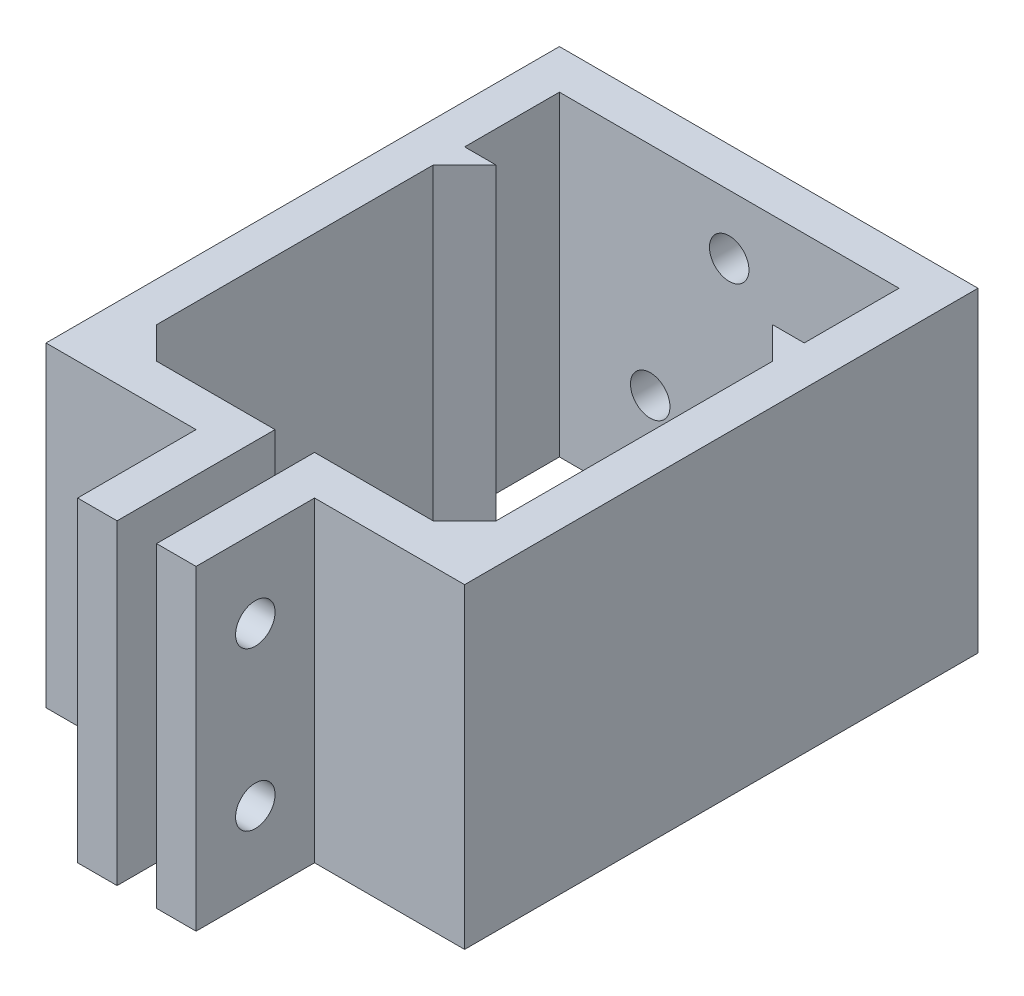
from build123d import *

# Parameters (mm, degrees)
MAIN_DEPTH          = 40
CHAMFER_1_SIZE      = 4
HOLES_REACH         = 105.966
SKETCH_2_R          = 2.5
EXTRUDE_3_DEPTH     = 40
CUT_EXTRUDE_4_REACH = 85.552
SKETCH_4_R          = 2.5


with BuildPart() as part:
    # Эскиз1 → main (new body)
    with BuildSketch(Plane(origin=(0, 0, 0), x_dir=(1, 0, 0), z_dir=(0, 1, 0))):
        Polygon((0, 0), (0, 65), (53, 65), (53, 0), (34, 0), (34, -15), (29, -15), (29, 5), (48, 5), (48, 60), (5, 60), (5, 5), (24, 5), (24, -15), (19, -15), (19, 0), align=None)
    extrude(amount=MAIN_DEPTH)

    # Фаска1
    chamfer_1_edges = [part.edges().sort_by_distance(p)[0] for p in [
        (48, 20, -5),
        (5, 20, -5),
    ]]
    chamfer(chamfer_1_edges, length=CHAMFER_1_SIZE)

    # Эскиз2 → holes (cut, up to next)
    with BuildSketch(Plane(origin=(0, 0, -65), x_dir=(-1, 0, 0), z_dir=(0, 0, -1)), mode=Mode.PRIVATE) as holes_sk1:
        with Locations((-26.5, 32.5)):
            Circle(SKETCH_2_R)
    holes_tool1 = extrude(holes_sk1.sketch, amount=-HOLES_REACH, mode=Mode.PRIVATE) & part.part
    # Эскиз2 → holes (cut, up to next)
    with BuildSketch(Plane(origin=(0, 0, -65), x_dir=(-1, 0, 0), z_dir=(0, 0, -1)), mode=Mode.PRIVATE) as holes_sk2:
        with Locations((-36.5, 12.5)):
            Circle(SKETCH_2_R)
    holes_tool2 = extrude(holes_sk2.sketch, amount=-HOLES_REACH, mode=Mode.PRIVATE) & part.part
    # Эскиз2 → holes (cut, up to next)
    with BuildSketch(Plane(origin=(0, 0, -65), x_dir=(-1, 0, 0), z_dir=(0, 0, -1)), mode=Mode.PRIVATE) as holes_sk3:
        with Locations((-16.5, 12.5)):
            Circle(SKETCH_2_R)
    holes_tool3 = extrude(holes_sk3.sketch, amount=-HOLES_REACH, mode=Mode.PRIVATE) & part.part
    add(holes_tool1.solids().sort_by_distance((26.5, 32.5, -65))[0], mode=Mode.SUBTRACT)
    add(holes_tool2.solids().sort_by_distance((36.5, 12.5, -65))[0], mode=Mode.SUBTRACT)
    add(holes_tool3.solids().sort_by_distance((16.5, 12.5, -65))[0], mode=Mode.SUBTRACT)

    # Эскиз3 → Вытянуть3 (add)
    with BuildSketch(Plane(origin=(0, 0, 0), x_dir=(1, 0, 0), z_dir=(0, 1, 0))):
        Polygon((5, 44), (5, 48), (9, 48), align=None)
        Polygon((44, 48), (48, 44), (48, 48), align=None)
    extrude(amount=EXTRUDE_3_DEPTH)

    # Вытянуть4: up to this face of the body (flat: up to its plane)
    cut_extrude_4_end = Plane(part.part.faces().sort_by_distance((19, 20, 7.5))[0])
    # Эскиз4 → Вытянуть4 (cut, up to the picked face)
    with BuildSketch(Plane(origin=(34, 0, 0), x_dir=(0, 0, -1), z_dir=(1, 0, 0)), mode=Mode.PRIVATE) as cut_extrude_4_sk1:
        with Locations((-7.5, 10)):
            Circle(SKETCH_4_R)
    cut_extrude_4_tool1 = split(extrude(cut_extrude_4_sk1.sketch, amount=-CUT_EXTRUDE_4_REACH, mode=Mode.PRIVATE), bisect_by=cut_extrude_4_end, keep=Keep.BOTH, mode=Mode.PRIVATE)
    # Эскиз4 → Вытянуть4 (cut, up to the picked face)
    with BuildSketch(Plane(origin=(34, 0, 0), x_dir=(0, 0, -1), z_dir=(1, 0, 0)), mode=Mode.PRIVATE) as cut_extrude_4_sk2:
        with Locations((-7.5, 30)):
            Circle(SKETCH_4_R)
    cut_extrude_4_tool2 = split(extrude(cut_extrude_4_sk2.sketch, amount=-CUT_EXTRUDE_4_REACH, mode=Mode.PRIVATE), bisect_by=cut_extrude_4_end, keep=Keep.BOTH, mode=Mode.PRIVATE)
    add(cut_extrude_4_tool1.solids().sort_by(Axis((34, 10, 7.5), (-1, 0, 0)))[0], mode=Mode.SUBTRACT)
    add(cut_extrude_4_tool2.solids().sort_by(Axis((34, 30, 7.5), (-1, 0, 0)))[0], mode=Mode.SUBTRACT)


solid = part.part
